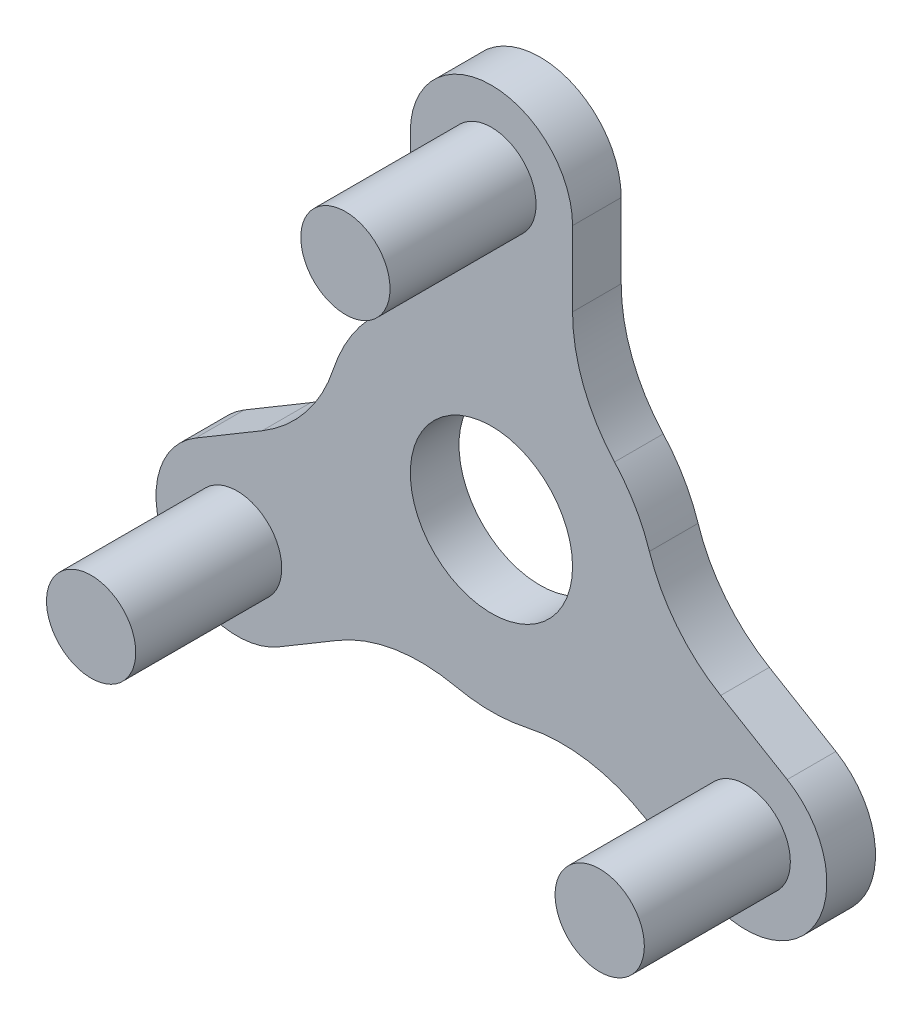
from build123d import *

# Parameters (mm, degrees)
SALIENTE_EXTRUIR1_DEPTH = 3
CROQUIS3_R              = 5
CORTAR_EXTRUIR2_DEPTH   = 10
REDONDEO1_R             = 10
CROQUIS2_R              = 2.75
SALIENTE_EXTRUIR2_DEPTH = 9


with BuildPart() as part:
    # Croquis1 → Saliente-Extruir1 (new body)
    with BuildSketch(Plane.XY):
        with BuildLine():
            Line((-13.118348224, -13.346885602), (-5.358962429, -8.729934305))
            ThreePointArc((-5.358962429, -8.729934305), (0, -10.243545836), (5.358962429, -8.729934305))
            Line((5.358962429, -8.729934305), (13.118348224, -13.346885602))
            ThreePointArc((13.118348224, -13.346885602), (19.97194541, -11.606711584), (18.231771393, -4.753114398))
            Line((18.231771393, -4.753114398), (10.243545836, 0))
            ThreePointArc((10.243545836, 0), (8.83594818, 5.182301714), (5, 8.94037087))
            Line((5, 8.94037087), (5, 18.2))
            ThreePointArc((5, 18.2), (0, 23.2), (-5, 18.2))
            Line((-5, 18.2), (-5, 8.94037087))
            ThreePointArc((-5, 8.94037087), (-8.83594818, 5.182301714), (-10.243545836, 0))
            Line((-10.243545836, 0), (-18.231771393, -4.753114398))
            ThreePointArc((-18.231771393, -4.753114398), (-19.97194541, -11.606711584), (-13.118348224, -13.346885602))
        make_face()
    extrude(amount=SALIENTE_EXTRUIR1_DEPTH)

    # Croquis3 → Cortar-Extruir2 (cut)
    with BuildSketch(Plane.XY.offset(3)):
        Circle(CROQUIS3_R)
    extrude(amount=-CORTAR_EXTRUIR2_DEPTH, mode=Mode.SUBTRACT)

    # Redondeo1
    redondeo1_edges = [part.edges().sort_by_distance(p)[0] for p in [
        (-10.243545836, 0, 1.5),
        (-5, 8.94037087, 1.5),
        (5, 8.94037087, 1.5),
        (10.243545836, 0, 1.5),
        (5.358962429, -8.729934305, 1.5),
        (-5.358962429, -8.729934305, 1.5),
    ]]
    fillet(redondeo1_edges, radius=REDONDEO1_R)

    # Croquis2 → Saliente-Extruir2 (add)
    with BuildSketch(Plane.XY.offset(3)):
        with Locations((0, 18.2)):
            Circle(CROQUIS2_R)
        with Locations((15.675059808, -9.05)):
            Circle(CROQUIS2_R)
        with Locations((-15.675059808, -9.05)):
            Circle(CROQUIS2_R)
    extrude(amount=SALIENTE_EXTRUIR2_DEPTH)


solid = part.part
